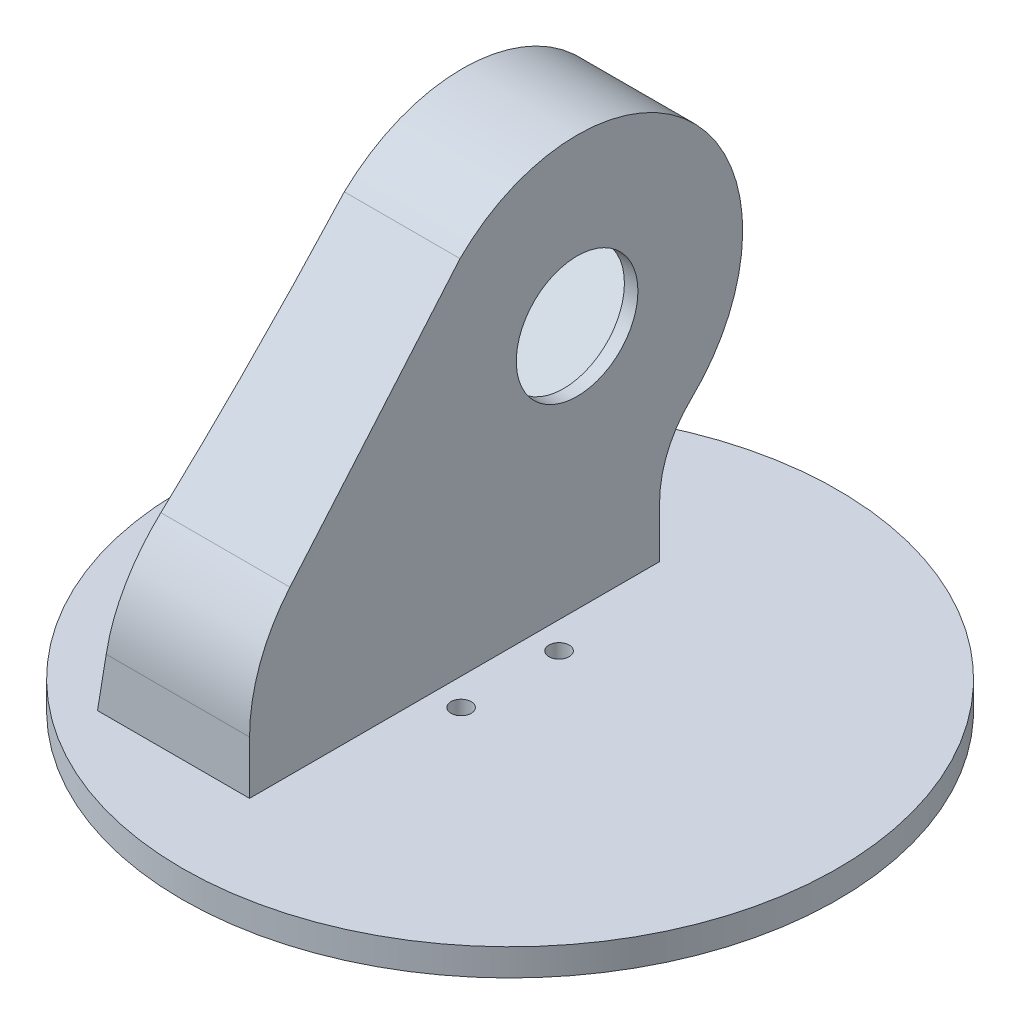
from build123d import *

# Parameters (mm, degrees)
SKETCH2_R                       = 48.5
BOSS_EXTRUDE1_DEPTH             = 4
SKETCH4_R                       = 1.5
CUT_EXTRUDE2_DEPTH              = 69.705894944
SKETCH5_R                       = 3.75
CUT_EXTRUDE3_DEPTH              = 1.5
BOSS_EXTRUDE2_DEPTH             = 14
CUT_EXTRUDE5_REACH              = 97.597
SKETCH9_R                       = 1.3
CUT_EXTRUDE6_DEPTH              = 7.5
CUT_EXTRUDE9_REACH              = 96.471
SKETCH11_R                      = 9
BOSS_EXTRUDE7_DEPTH             = 9
BOSS_EXTRUDE7_DIRECTION_2_REACH = 104.912
BOSS_EXTRUDE10_DEPTH            = 9
CUT_EXTRUDE17_DEPTH             = 95.342420983
CUT_EXTRUDE17_DEPTH_BACK        = 95.342420983


with BuildPart() as part:
    # Sketch2 → Boss-Extrude1 (new body)
    with BuildSketch(Plane(origin=(0, 0, 0), x_dir=(1, 0, 0), z_dir=(0, 1, 0))):
        with Locations(Location((0, 0, 0), (0, 0, 270))):
            Circle(SKETCH2_R)
    extrude(amount=BOSS_EXTRUDE1_DEPTH)

    # Sketch4 → Cut-Extrude2 (cut, through all)
    with BuildSketch(Plane.XZ):
        with Locations(Location((0, 7.25, 0), (0, 0, 270))):
            Circle(SKETCH4_R)
        with Locations(Location((0, -7.25, 0), (0, 0, 270))):
            Circle(SKETCH4_R)
    extrude(amount=-CUT_EXTRUDE2_DEPTH, mode=Mode.SUBTRACT)

    # Sketch5 → Cut-Extrude3 (cut)
    with BuildSketch(Plane.XZ):
        with Locations(Location((0, 0, 0), (0, 0, 270))):
            Circle(SKETCH5_R)
    extrude(amount=-CUT_EXTRUDE3_DEPTH, mode=Mode.SUBTRACT)

    # Sketch7 → Boss-Extrude2 (add)
    with BuildSketch(Plane(origin=(-4, 0, 0), x_dir=(0, 0, -1), z_dir=(1, 0, 0))):
        with BuildLine():
            Line((23.129947874, 4), (23.129947874, 11.644549616))
            ThreePointArc((23.129947874, 11.644549616), (24.589048403, 18.743749901), (28.729797284, 24.692011643))
            ThreePointArc((28.729797284, 24.692011643), (29.313383054, 55.284736897), (-1.284289494, 55.479275971))
            Line((-1.284289494, 55.479275971), (-27.227315747, 29.536249718))
            ThreePointArc((-27.227315747, 29.536249718), (-32.64663453, 21.425665997), (-34.549646217, 11.858580188))
            Line((-34.549646217, 11.858580188), (-34.549646217, 4))
            Line((-34.549646217, 4), (23.129947874, 4))
        make_face()
    extrude(amount=-BOSS_EXTRUDE2_DEPTH)

    # Sketch8 → Cut-Extrude5 (cut, up to next)
    with BuildSketch(Plane(origin=(-6, 0, 0), x_dir=(0, 0, -1), z_dir=(1, 0, 0)), mode=Mode.PRIVATE) as cut_extrude5_sk1:
        Polygon((-15.249648422, 25.957567857), (13.741729607, 54.948945886), (28.590972012, 40.099703481), (-0.400406017, 11.108325452), align=None)
    cut_extrude5_tool1 = extrude(cut_extrude5_sk1.sketch, amount=-CUT_EXTRUDE5_REACH, mode=Mode.PRIVATE) & part.part
    add(cut_extrude5_tool1.solids().sort_by_distance((-6, 33.028636, -6.670662))[0], mode=Mode.SUBTRACT)

    # Sketch9 → Cut-Extrude6 (cut)
    with BuildSketch(Plane.ZY.offset(18)):
        with Locations((-20.105690637, 53.534732323)):
            Circle(SKETCH9_R)
        with Locations((-27.176758449, 46.463664511)):
            Circle(SKETCH9_R)
        with Locations((6.764367048, 12.522539014)):
            Circle(SKETCH9_R)
        with Locations((13.83543486, 19.593606826)):
            Circle(SKETCH9_R)
    extrude(amount=-CUT_EXTRUDE6_DEPTH, mode=Mode.SUBTRACT)

    # Sketch11 → Cut-Extrude9 (cut, up to next)
    with BuildSketch(Plane(origin=(-4, 0, 0), x_dir=(0, 0, -1), z_dir=(1, 0, 0)), mode=Mode.PRIVATE) as cut_extrude9_sk1:
        with Locations((13.918506302, 40.276480176)):
            Circle(SKETCH11_R)
    cut_extrude9_tool1 = extrude(cut_extrude9_sk1.sketch, amount=-CUT_EXTRUDE9_REACH, mode=Mode.PRIVATE) & part.part
    add(cut_extrude9_tool1.solids().sort_by_distance((-4, 40.27648, -13.918506))[0], mode=Mode.SUBTRACT)

    # Sketch17 → Boss-Extrude7 (add)
    with BuildSketch(Plane.ZY.offset(18)):
        with BuildLine():
            ThreePointArc((34.549646217, 11.858580188), (33.008342843, 20.500891953), (28.574482006, 28.077569775))
            ThreePointArc((28.574482006, 28.077569775), (27.915386359, 28.820289685), (27.227315747, 29.536249718))
            Line((27.227315747, 29.536249718), (1.284289494, 55.479275971))
            Line((1.284289494, 55.479275971), (26.295003593, 26.127182305))
            ThreePointArc((26.295003593, 26.127182305), (30.194232218, 19.461281607), (31.549646217, 11.858580188))
            Line((31.549646217, 11.858580188), (31.549646217, 4))
            Line((31.549646217, 4), (34.549646217, 4))
            Line((34.549646217, 4), (34.549646217, 11.858580188))
        make_face()
        with BuildLine():
            Line((28.574482006, 28.077569775), (3.405609837, 57.600596315))
            ThreePointArc((3.405609837, 57.600596315), (-31.461505391, 57.378912253), (-30.796489049, 22.517434639))
            ThreePointArc((-30.796489049, 22.517434639), (-27.345864981, 17.560549854), (-26.129947874, 11.644549616))
            Line((-26.129947874, 11.644549616), (-26.129947874, 4))
            Line((-26.129947874, 4), (-23.129947874, 4))
            Line((-23.129947874, 4), (-23.129947874, 11.644549616))
            ThreePointArc((-23.129947874, 11.644549616), (-24.589048403, 18.743749901), (-28.729797284, 24.692011643))
            ThreePointArc((-28.729797284, 24.692011643), (-29.313383054, 55.284736897), (1.284289494, 55.479275971))
            Line((1.284289494, 55.479275971), (27.227315747, 29.536249718))
            ThreePointArc((27.227315747, 29.536249718), (27.915386359, 28.820289685), (28.574482006, 28.077569775))
        make_face()
    extrude(amount=BOSS_EXTRUDE7_DEPTH)

    # Boss-Extrude7 direction 2: up to this face of the body (flat: up to its plane)
    boss_extrude7_direction_2_end = Plane(part.part.faces().sort_by_distance((-4, 28.276431801, -1.649713195))[0])
    # Sketch17 → Boss-Extrude7 direction 2 (add, up to the picked face)
    with BuildSketch(Plane.ZY.offset(18), mode=Mode.PRIVATE) as boss_extrude7_direction_2_sk1:
        with BuildLine():
            ThreePointArc((34.549646217, 11.858580188), (33.008342843, 20.500891953), (28.574482006, 28.077569775))
            ThreePointArc((28.574482006, 28.077569775), (27.915386359, 28.820289685), (27.227315747, 29.536249718))
            Line((27.227315747, 29.536249718), (1.284289494, 55.479275971))
            Line((1.284289494, 55.479275971), (26.295003593, 26.127182305))
            ThreePointArc((26.295003593, 26.127182305), (30.194232218, 19.461281607), (31.549646217, 11.858580188))
            Line((31.549646217, 11.858580188), (31.549646217, 4))
            Line((31.549646217, 4), (34.549646217, 4))
            Line((34.549646217, 4), (34.549646217, 11.858580188))
        make_face()
    boss_extrude7_direction_2_tool1 = split(extrude(boss_extrude7_direction_2_sk1.sketch, amount=-BOSS_EXTRUDE7_DIRECTION_2_REACH, mode=Mode.PRIVATE), bisect_by=boss_extrude7_direction_2_end, keep=Keep.BOTH, mode=Mode.PRIVATE)
    # Sketch17 → Boss-Extrude7 direction 2 (add, up to the picked face)
    with BuildSketch(Plane.ZY.offset(18), mode=Mode.PRIVATE) as boss_extrude7_direction_2_sk2:
        with BuildLine():
            Line((28.574482006, 28.077569775), (3.405609837, 57.600596315))
            ThreePointArc((3.405609837, 57.600596315), (-31.461505391, 57.378912253), (-30.796489049, 22.517434639))
            ThreePointArc((-30.796489049, 22.517434639), (-27.345864981, 17.560549854), (-26.129947874, 11.644549616))
            Line((-26.129947874, 11.644549616), (-26.129947874, 4))
            Line((-26.129947874, 4), (-23.129947874, 4))
            Line((-23.129947874, 4), (-23.129947874, 11.644549616))
            ThreePointArc((-23.129947874, 11.644549616), (-24.589048403, 18.743749901), (-28.729797284, 24.692011643))
            ThreePointArc((-28.729797284, 24.692011643), (-29.313383054, 55.284736897), (1.284289494, 55.479275971))
            Line((1.284289494, 55.479275971), (27.227315747, 29.536249718))
            ThreePointArc((27.227315747, 29.536249718), (27.915386359, 28.820289685), (28.574482006, 28.077569775))
        make_face()
    boss_extrude7_direction_2_tool2 = split(extrude(boss_extrude7_direction_2_sk2.sketch, amount=-BOSS_EXTRUDE7_DIRECTION_2_REACH, mode=Mode.PRIVATE), bisect_by=boss_extrude7_direction_2_end, keep=Keep.BOTH, mode=Mode.PRIVATE)
    add(boss_extrude7_direction_2_tool1.solids().sort_by(Axis((-18, 4.612919, 33.049646), (1, 0, 0)))[0])
    add(boss_extrude7_direction_2_tool2.solids().sort_by(Axis((-18, 43.147366, 14.895406), (1, 0, 0)))[0])

    # Sketch25 → Boss-Extrude10 (add)
    with BuildSketch(Plane.ZY.offset(18)):
        with BuildLine():
            ThreePointArc((-28.729797284, 24.692011643), (-24.589048403, 18.743749901), (-23.129947874, 11.644549616))
            Line((-23.129947874, 11.644549616), (-23.129947874, 4))
            Line((-23.129947874, 4), (-15.129947874, 4))
            add(Edge.make_bspline(
                [(-28.729797284, 24.692011643), (-21.954867515, 18.253200081), (-19.09405247, 12.798017691), (-15.129947874, 4)],
                knots=[0, 0, 0, 0, 1, 1, 1, 1], degree=3))
        make_face()
        with BuildLine():
            add(Edge.make_bspline(
                [(11.751619577, 43.19501844), (26.551255916, 25.8264495), (25.549646217, 4)],
                knots=[0, 0, 0, 1, 1, 1], degree=2))
            Line((25.549646217, 4), (31.549646217, 4))
            Line((31.549646217, 4), (31.549646217, 11.858580188))
            ThreePointArc((31.549646217, 11.858580188), (30.194232218, 19.461281607), (26.295003593, 26.127182305))
            Line((26.295003593, 26.127182305), (11.751619577, 43.19501844))
        make_face()
    extrude(amount=BOSS_EXTRUDE10_DEPTH)

    # Sketch29 → Cut-Extrude17 (cut, two sides: drawn at the far end of the back side and taken through both)
    with BuildSketch(Plane.XY.offset(-CUT_EXTRUDE17_DEPTH_BACK)):
        with BuildLine():
            Line((-21, 64.776480176), (-27, 64.776480176))
            Line((-27, 64.776480176), (-27, 4))
            Line((-27, 4), (-26.5, 4))
            add(Edge.make_bspline(
                [(-21, 64.776480176), (-21.220459696, 34.140901434), (-26.5, 4)],
                knots=[0, 0, 0, 1, 1, 1], degree=2))
        make_face()
    extrude(amount=CUT_EXTRUDE17_DEPTH + CUT_EXTRUDE17_DEPTH_BACK, mode=Mode.SUBTRACT)


solid = part.part
